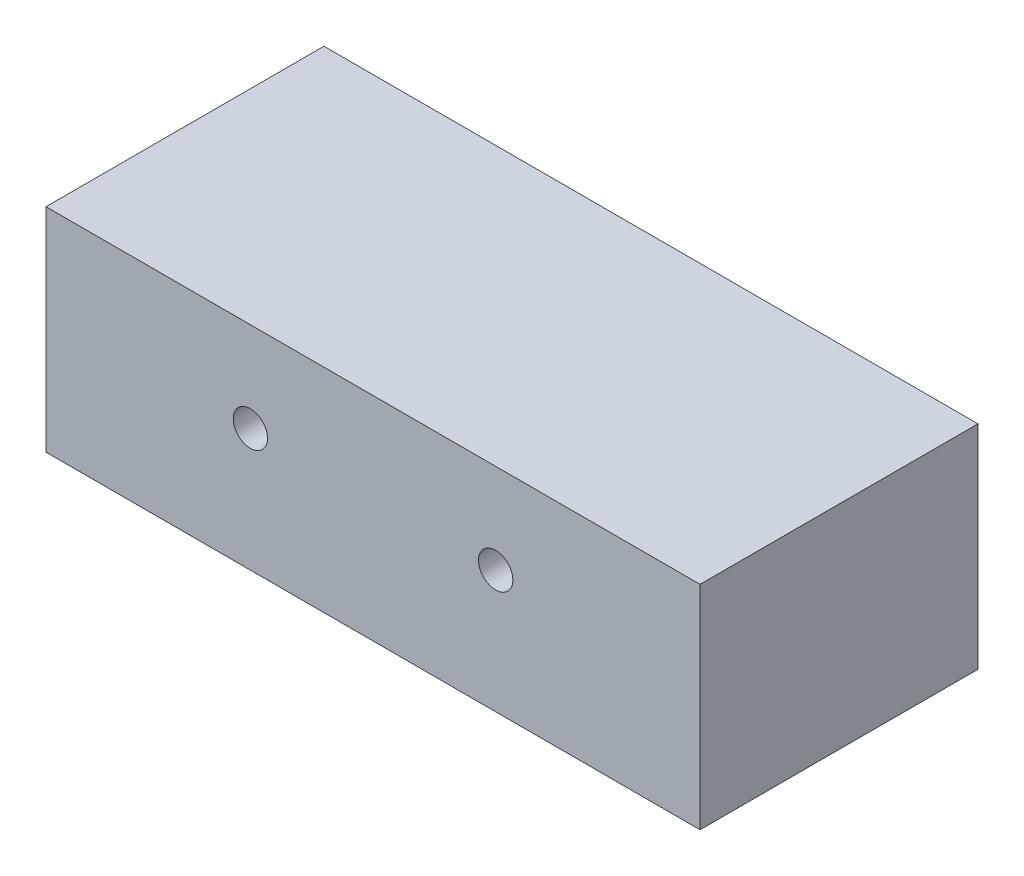
from build123d import *

# Parameters (mm, degrees)
SKETCH_1_W             = 80
SKETCH_1_H             = 26
EXTRUDE_1_DEPTH        = 34
HOLE_WIZARD_M5_1_D     = 4.2
HOLE_WIZARD_M5_1_DEPTH = 12.4
HOLE_WIZARD_M5_1_TIP   = 1.2618073
HOLE_WIZARD_M5_2_D     = 4.2
HOLE_WIZARD_M5_2_DEPTH = 12.4
HOLE_WIZARD_M5_2_TIP   = 1.2618073


with BuildPart() as part:
    # 草图1 → 凸台-拉伸1 (new body)
    with BuildSketch(Plane.XY):
        with Locations((40, 13)):
            Rectangle(SKETCH_1_W, SKETCH_1_H)
    extrude(amount=EXTRUDE_1_DEPTH)

    # M5 螺纹孔1
    with Locations(Plane(origin=(0, 0, 0), x_dir=(-1, 0, 0), z_dir=(0, 0, -1))):
        with Locations((-55, 15), (-25, 15)):
            Hole(HOLE_WIZARD_M5_1_D / 2, depth=HOLE_WIZARD_M5_1_DEPTH)
            with Locations((0, 0, -(HOLE_WIZARD_M5_1_DEPTH + HOLE_WIZARD_M5_1_TIP / 2))):  # 118° drill point
                Cone(0, HOLE_WIZARD_M5_1_D / 2, HOLE_WIZARD_M5_1_TIP, mode=Mode.SUBTRACT)

    # M5 螺纹孔2
    with Locations(Plane.XY.offset(34)):
        with Locations((25, 15), (55, 15)):
            Hole(HOLE_WIZARD_M5_2_D / 2, depth=HOLE_WIZARD_M5_2_DEPTH)
            with Locations((0, 0, -(HOLE_WIZARD_M5_2_DEPTH + HOLE_WIZARD_M5_2_TIP / 2))):  # 118° drill point
                Cone(0, HOLE_WIZARD_M5_2_D / 2, HOLE_WIZARD_M5_2_TIP, mode=Mode.SUBTRACT)


solid = part.part
